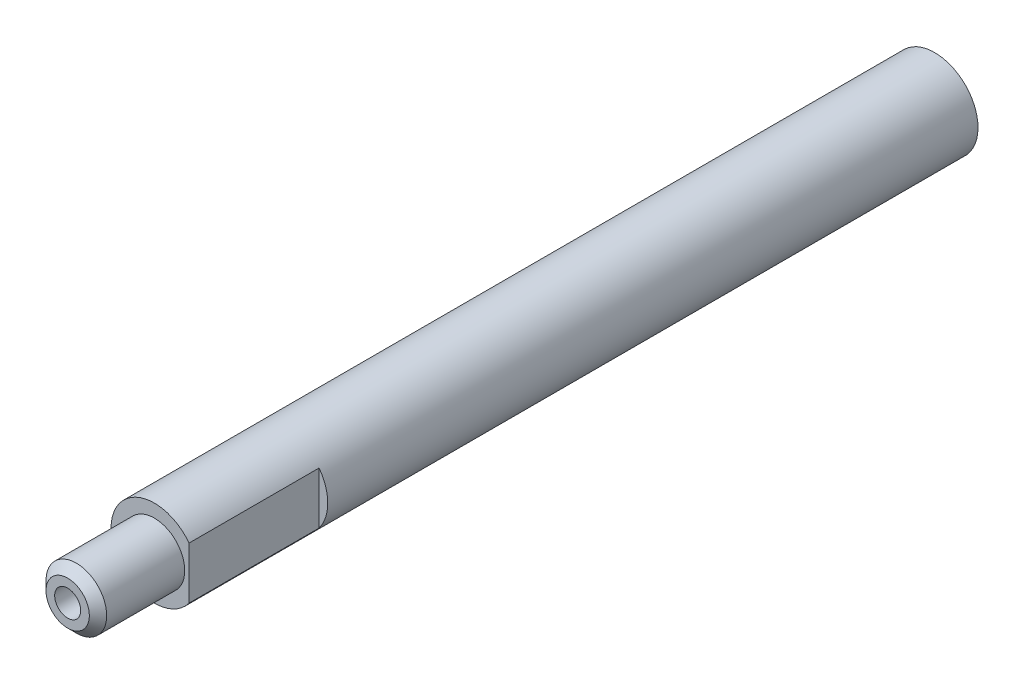
from build123d import *

# Parameters (mm, degrees)
SKETCH1_R                = 5
BASE_EXTRUDE_DEPTH       = 100
SKETCH7_OUTSIDE_W        = 32.2
SKETCH7_OUTSIDE_H        = 32.2
SKETCH7_OUTSIDE_R        = 3.5
FRONT_CUT_DEPTH          = 10
FRONT_HOLE_D             = 3
FRONT_HOLE_DEPTH         = 10
FRONT_HOLE_TIP           = 0.901290929
CHAMFER1_SIZE            = 1
KEYWAY_START             = -15
KEYWAY_CUT_DEPTH         = 15
F_4_0_4_BLACK_HOLE_D     = 4
F_4_0_4_BLACK_HOLE_DEPTH = 20
F_4_0_4_BLACK_HOLE_TIP   = 1.201721238


with BuildPart() as part:
    # Sketch1 → Base Extrude (new body)
    with BuildSketch(Plane.XY):
        Circle(SKETCH1_R)
    extrude(amount=BASE_EXTRUDE_DEPTH)

    # Sketch7 outside → Front Cut (cut)
    with BuildSketch(Plane.XY.offset(100)):
        Rectangle(SKETCH7_OUTSIDE_W, SKETCH7_OUTSIDE_H)
        Circle(SKETCH7_OUTSIDE_R, mode=Mode.SUBTRACT)
    extrude(amount=-FRONT_CUT_DEPTH, mode=Mode.SUBTRACT)

    # Front Hole
    with Locations(Plane.XY.offset(100)):
        with Locations((0, 0)):
            Hole(FRONT_HOLE_D / 2, depth=FRONT_HOLE_DEPTH)
            with Locations((0, 0, -(FRONT_HOLE_DEPTH + FRONT_HOLE_TIP / 2))):  # 118° drill point
                Cone(0, FRONT_HOLE_D / 2, FRONT_HOLE_TIP, mode=Mode.SUBTRACT)

    # Chamfer1
    chamfer1_edges = [part.edges().sort_by_distance(p)[0] for p in [
        (-3.5, 0, 100),
    ]]
    chamfer(chamfer1_edges, length=CHAMFER1_SIZE)

    # Keyway → Keyway Cut (cut)
    with BuildSketch(Plane.XY.offset(90).offset(KEYWAY_START)):
        with BuildLine():
            Line((4, 3), (4, -3))
            ThreePointArc((4, -3), (5, 0), (4, 3))
        make_face()
    extrude(amount=KEYWAY_CUT_DEPTH, mode=Mode.SUBTRACT)

    # Ø4.0 (4) Black Hole
    with Locations(Plane(origin=(0, 0, 0), x_dir=(-1, 0, 0), z_dir=(0, 0, -1))):
        with Locations((0, 0)):
            Hole(F_4_0_4_BLACK_HOLE_D / 2, depth=F_4_0_4_BLACK_HOLE_DEPTH)
            with Locations((0, 0, -(F_4_0_4_BLACK_HOLE_DEPTH + F_4_0_4_BLACK_HOLE_TIP / 2))):  # 118° drill point
                Cone(0, F_4_0_4_BLACK_HOLE_D / 2, F_4_0_4_BLACK_HOLE_TIP, mode=Mode.SUBTRACT)


solid = part.part
